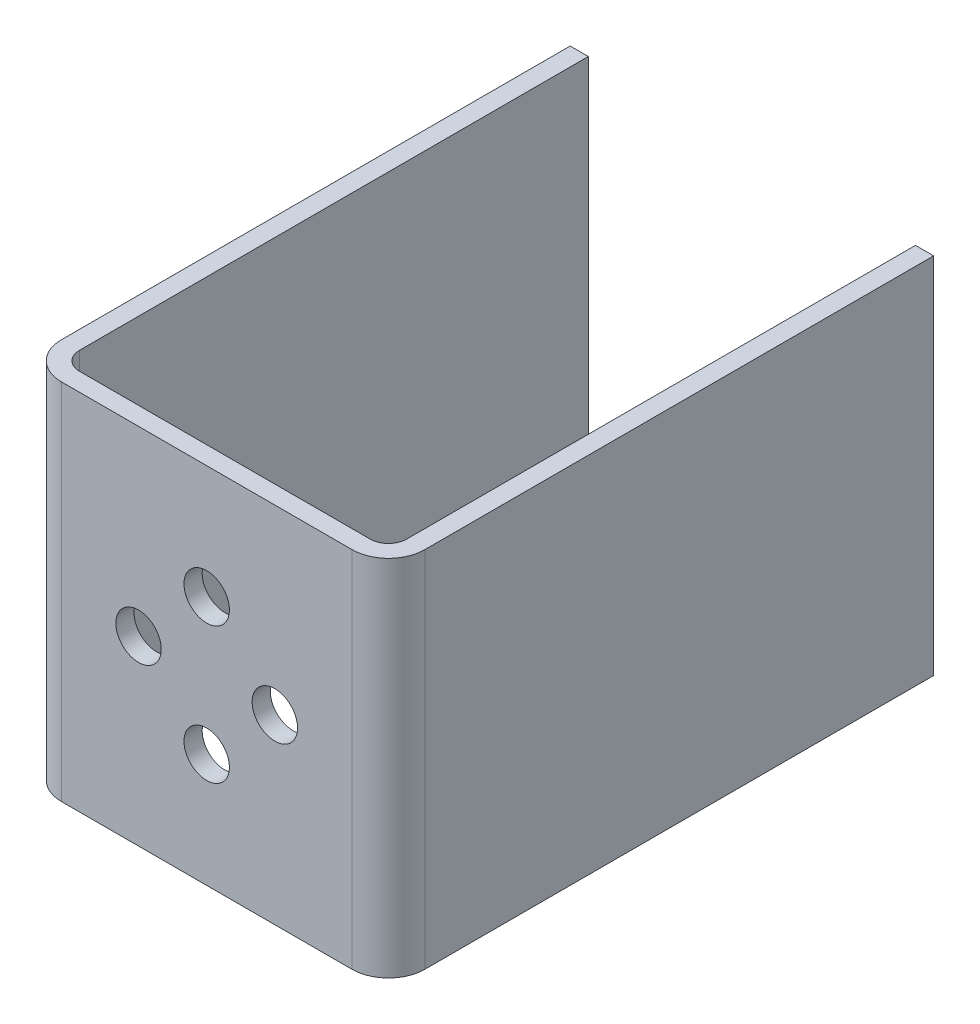
from build123d import *

# Parameters (mm, degrees)
BOSS_EXTRUDE1_DEPTH = 50.8
SKETCH2_R           = 3.175
CUT_EXTRUDE2_DEPTH  = 103.893515831


with BuildPart() as part:
    # Sketch1 → Boss-Extrude1 (new body)
    with BuildSketch(Plane(origin=(0, 0, 0), x_dir=(1, 0, 0), z_dir=(0, 1, 0))):
        with BuildLine():
            Line((0, 76.2), (2.54, 76.2))
            Line((2.54, 76.2), (2.54, 5.08))
            ThreePointArc((2.54, 5.08), (3.283948776, 3.283948776), (5.08, 2.54))
            Line((5.08, 2.54), (45.72, 2.54))
            ThreePointArc((45.72, 2.54), (47.516051224, 3.283948776), (48.26, 5.08))
            Line((48.26, 5.08), (48.26, 76.2))
            Line((48.26, 76.2), (50.8, 76.2))
            Line((50.8, 76.2), (50.8, 5.08))
            ThreePointArc((50.8, 5.08), (49.312102448, 1.487897552), (45.72, 0))
            Line((45.72, 0), (5.08, 0))
            ThreePointArc((5.08, 0), (1.487897552, 1.487897552), (0, 5.08))
            Line((0, 5.08), (0, 76.2))
        make_face()
    extrude(amount=BOSS_EXTRUDE1_DEPTH)

    # Sketch2 → Cut-Extrude2 (cut, through all)
    with BuildSketch(Plane(origin=(0, 0, -2.54), x_dir=(-1, 0, 0), z_dir=(0, 0, -1))):
        with Locations((-34.925, 25.4)):
            Circle(SKETCH2_R)
        with Locations((-25.4, 34.925)):
            Circle(SKETCH2_R)
        with Locations((-15.875, 25.4)):
            Circle(SKETCH2_R)
        with Locations((-25.4, 15.875)):
            Circle(SKETCH2_R)
    extrude(amount=-CUT_EXTRUDE2_DEPTH, mode=Mode.SUBTRACT)


solid = part.part
